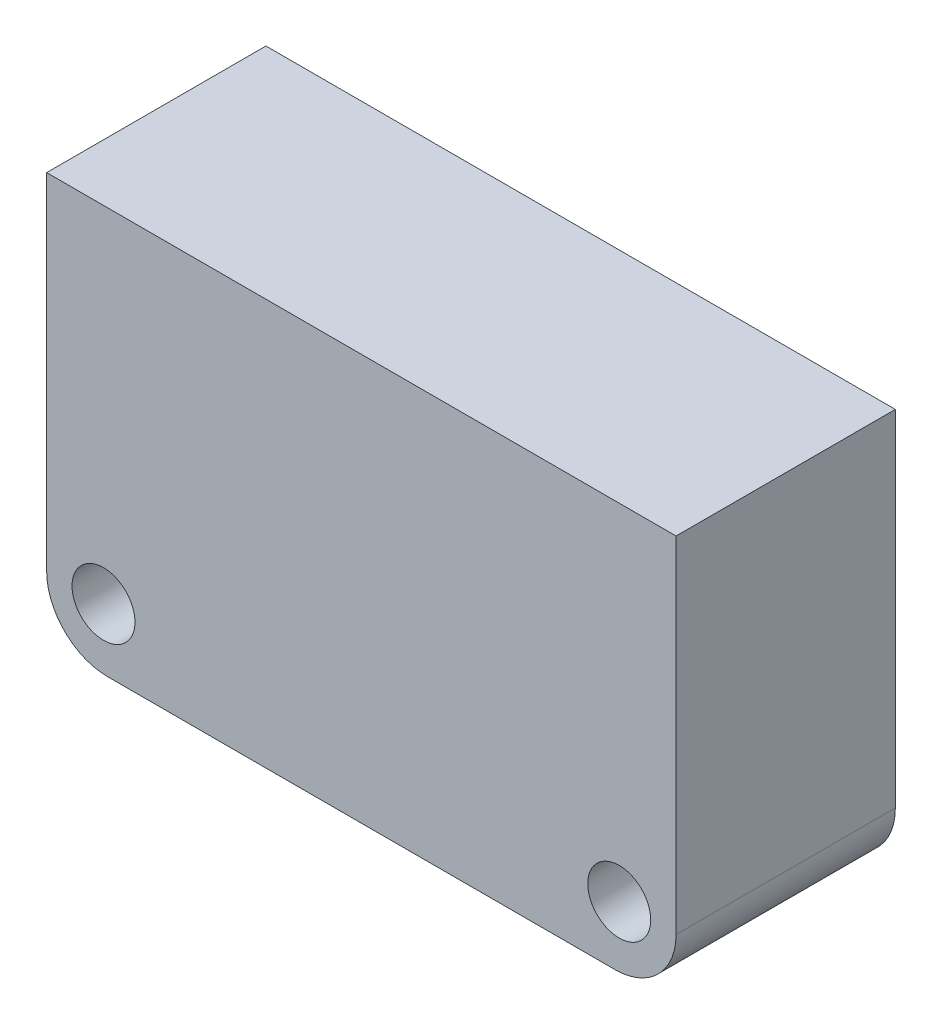
from build123d import *

# Parameters (mm, degrees)
SKETCH_1_W          = 31
SKETCH_1_H          = 20
EXTRUDE_1_DEPTH     = 10.8
SKETCH_2_R          = 1.55
CUT_EXTRUDE_1_DEPTH = 22.37498538
FILLET_1_R          = 3
FILLET_2_R          = 3
SKETCH_3_W          = 15
SKETCH_3_H          = 5
CUT_EXTRUDE_2_DEPTH = 3


with BuildPart() as part:
    # 草图1 → 凸台-拉伸1 (new body)
    with BuildSketch(Plane.XY):
        Rectangle(SKETCH_1_W, SKETCH_1_H)
    extrude(amount=EXTRUDE_1_DEPTH)

    # 草图2 → 切除-拉伸1 (cut, through all)
    with BuildSketch(Plane(origin=(0, 0, 0), x_dir=(-1, 0, 0), z_dir=(0, 0, -1))):
        with Locations((-12.7, -7)):
            Circle(SKETCH_2_R)
        with Locations((12.7, -7)):
            Circle(SKETCH_2_R)
    extrude(amount=-CUT_EXTRUDE_1_DEPTH, mode=Mode.SUBTRACT)

    # 圆角1
    fillet_1_edges = [part.edges().sort_by_distance(p)[0] for p in [
        (-15.5, -10, 5.4),
    ]]
    fillet(fillet_1_edges, radius=FILLET_1_R)

    # 圆角2
    fillet_2_edges = [part.edges().sort_by_distance(p)[0] for p in [
        (15.5, -10, 5.4),
    ]]
    fillet(fillet_2_edges, radius=FILLET_2_R)

    # 草图3 → 切除-拉伸2 (cut)
    with BuildSketch(Plane.XZ.offset(10)):
        with Locations((0, 5.4)):
            Rectangle(SKETCH_3_W, SKETCH_3_H)
    extrude(amount=-CUT_EXTRUDE_2_DEPTH, mode=Mode.SUBTRACT)


solid = part.part
